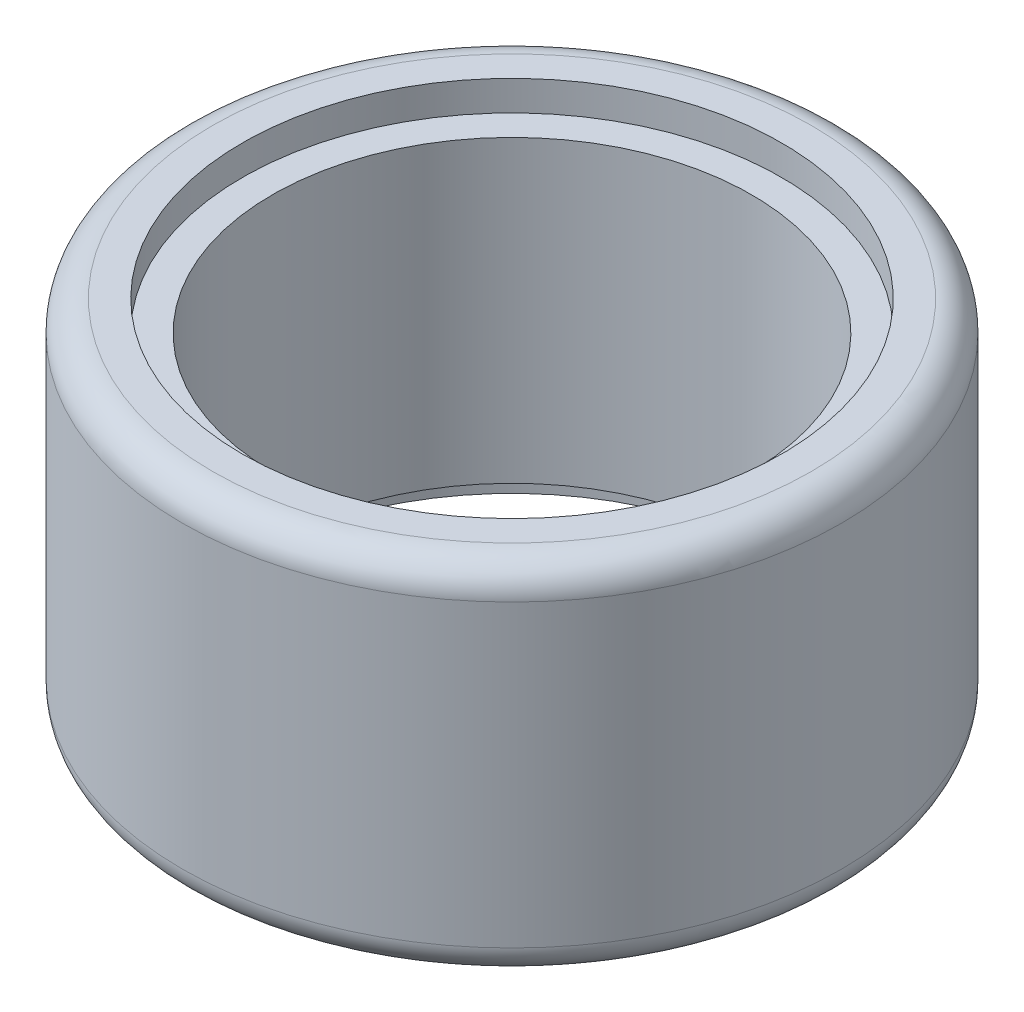
from build123d import *

# Parameters (mm, degrees)
SKETCH1_R           = 11
SKETCH1_R_2         = 8
BOSS_EXTRUDE1_DEPTH = 6
FILLET1_R           = 1
CUT_EXTRUDE1_START  = -1
SKETCH2_R           = 9
SKETCH2_R_2         = 8
CUT_EXTRUDE1_DEPTH  = 1


with BuildPart() as part:
    # Sketch1 → Boss-Extrude1 (new, symmetric)
    with BuildSketch(Plane(origin=(0, 0, 0), x_dir=(1, 0, 0), z_dir=(0, 1, 0))):
        with Locations(Location((0, 0, 0), (0, 0, 270))):
            Circle(SKETCH1_R)
        with Locations(Location((0, 0, 0), (0, 0, 270))):
            Circle(SKETCH1_R_2, mode=Mode.SUBTRACT)
    extrude(amount=BOSS_EXTRUDE1_DEPTH, both=True)

    # Fillet1
    fillet1_edges = [part.edges().sort_by_distance(p)[0] for p in [
        (0, -6, -11),
        (0, 6, -11),
    ]]
    fillet(fillet1_edges, radius=FILLET1_R)

    # Sketch2 → Cut-Extrude1 (cut)
    with BuildSketch(Plane(origin=(0, 6, 0), x_dir=(1, 0, 0), z_dir=(0, 1, 0)).offset(CUT_EXTRUDE1_START)):
        with Locations(Location((0, 0, 0), (0, 0, 270))):
            Circle(SKETCH2_R)
        with Locations(Location((0, 0, 0), (0, 0, 270))):
            Circle(SKETCH2_R_2, mode=Mode.SUBTRACT)
    cut_extrude1 = extrude(amount=CUT_EXTRUDE1_DEPTH, mode=Mode.SUBTRACT)

    # Mirror1: Cut-Extrude1 across plane
    add(cut_extrude1.mirror(Plane.ZX), mode=Mode.SUBTRACT)


solid = part.part
